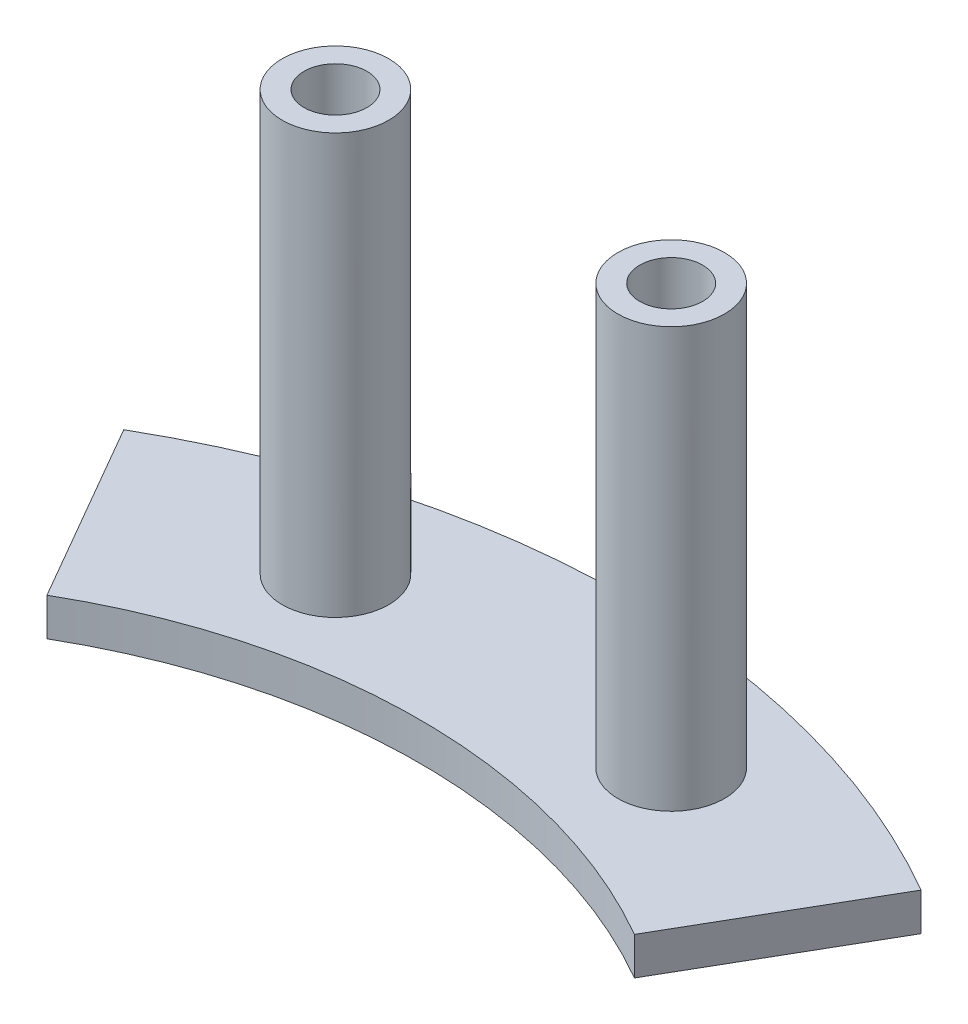
from build123d import *

# Parameters (mm, degrees)
BOSS_EXTRUDE1_DEPTH = 1.8
SKETCH2_R           = 2.54
BOSS_EXTRUDE2_DEPTH = 20
SKETCH5_R           = 1.5
CUT_EXTRUDE1_DEPTH  = 3


with BuildPart() as part:
    # Sketch1 → Boss-Extrude1 (new body)
    with BuildSketch(Plane(origin=(0, 0, 0), x_dir=(1, 0, 0), z_dir=(0, 1, 0))):
        with BuildLine():
            Line((-19, 32.908965344), (-14, 24.248711306))
            ThreePointArc((-14, 24.248711306), (0, 28), (14, 24.248711306))
            Line((14, 24.248711306), (19, 32.908965344))
            ThreePointArc((19, 32.908965344), (0, 38), (-19, 32.908965344))
        make_face()
    extrude(amount=BOSS_EXTRUDE1_DEPTH)

    # Sketch2 → Boss-Extrude2 (add)
    with BuildSketch(Plane(origin=(0, 1.8, 0), x_dir=(1, 0, 0), z_dir=(0, 1, 0))):
        with Locations(Location((-8, 32, 0), (0, 0, 90))):
            Circle(SKETCH2_R)
        with Locations(Location((8, 32, 0), (0, 0, 90))):
            Circle(SKETCH2_R)
    extrude(amount=BOSS_EXTRUDE2_DEPTH)

    # Sketch5 → Cut-Extrude1 (cut)
    with BuildSketch(Plane(origin=(0, 21.8, 0), x_dir=(1, 0, 0), z_dir=(0, 1, 0))):
        with Locations(Location((-8, 32, 0), (0, 0, 270))):
            Circle(SKETCH5_R)
        with Locations(Location((8, 32, 0), (0, 0, 270))):
            Circle(SKETCH5_R)
    extrude(amount=-CUT_EXTRUDE1_DEPTH, mode=Mode.SUBTRACT)


solid = part.part
